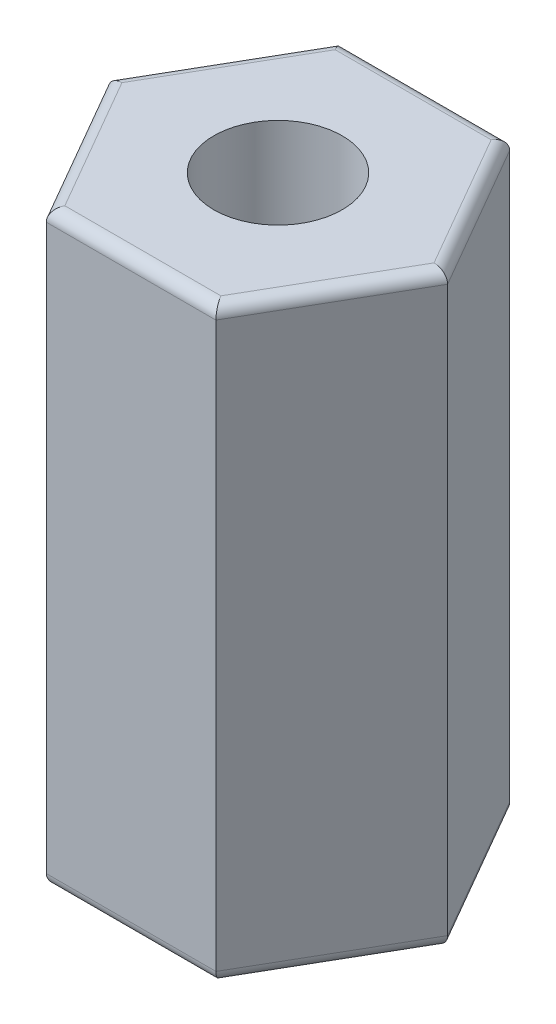
from build123d import *

# Parameters (mm, degrees)
RESSALTO_EXTRUS_O1_DEPTH = 10
FILETE1_R                = 0.2
ESBO_O3_R                = 1.0922
CORTE_EXTRUS_O1_DEPTH    = 5
CORTE_EXTRUS_O2_START    = -5
ESBO_O2_R                = 1.0922
CORTE_EXTRUS_O2_DEPTH    = 5


with BuildPart() as part:
    # Esboço1 → Ressalto-extrusão1 (new body)
    with BuildSketch(Plane(origin=(0, 0, 0), x_dir=(1, 0, 0), z_dir=(0, 1, 0))):
        Polygon((2.886751346, 0), (1.443375673, 2.5), (-1.443375673, 2.5), (-2.886751346, 0), (-1.443375673, -2.5), (1.443375673, -2.5), align=None)
    extrude(amount=RESSALTO_EXTRUS_O1_DEPTH)

    # Filete1
    filete1_edges = [part.edges().sort_by_distance(p)[0] for p in [
        (0, 10, -2.5),
        (-2.165063509, 10, -1.25),
        (-2.165063509, 10, 1.25),
        (0, 10, 2.5),
        (2.165063509, 10, 1.25),
        (0, 0, 2.5),
        (-2.165063509, 0, 1.25),
        (-2.165063509, 0, -1.25),
        (2.165063509, 10, -1.25),
        (0, 0, -2.5),
        (2.165063509, 0, -1.25),
        (2.165063509, 0, 1.25),
    ]]
    fillet(filete1_edges, radius=FILETE1_R)

    # Esboço3 → Corte-extrusão1 (cut)
    with BuildSketch(Plane(origin=(0, 10, 0), x_dir=(1, 0, 0), z_dir=(0, 1, 0))):
        with Locations(Location((0, 0, 0), (0, 0, 270))):
            Circle(ESBO_O3_R)
    extrude(amount=-CORTE_EXTRUS_O1_DEPTH, mode=Mode.SUBTRACT)

    # Esboço2 → Corte-extrusão2 (cut)
    with BuildSketch(Plane.XZ.offset(CORTE_EXTRUS_O2_START)):
        with Locations(Location((0, 0, 0), (0, 0, 90))):
            Circle(ESBO_O2_R)
    extrude(amount=CORTE_EXTRUS_O2_DEPTH, mode=Mode.SUBTRACT)


solid = part.part
